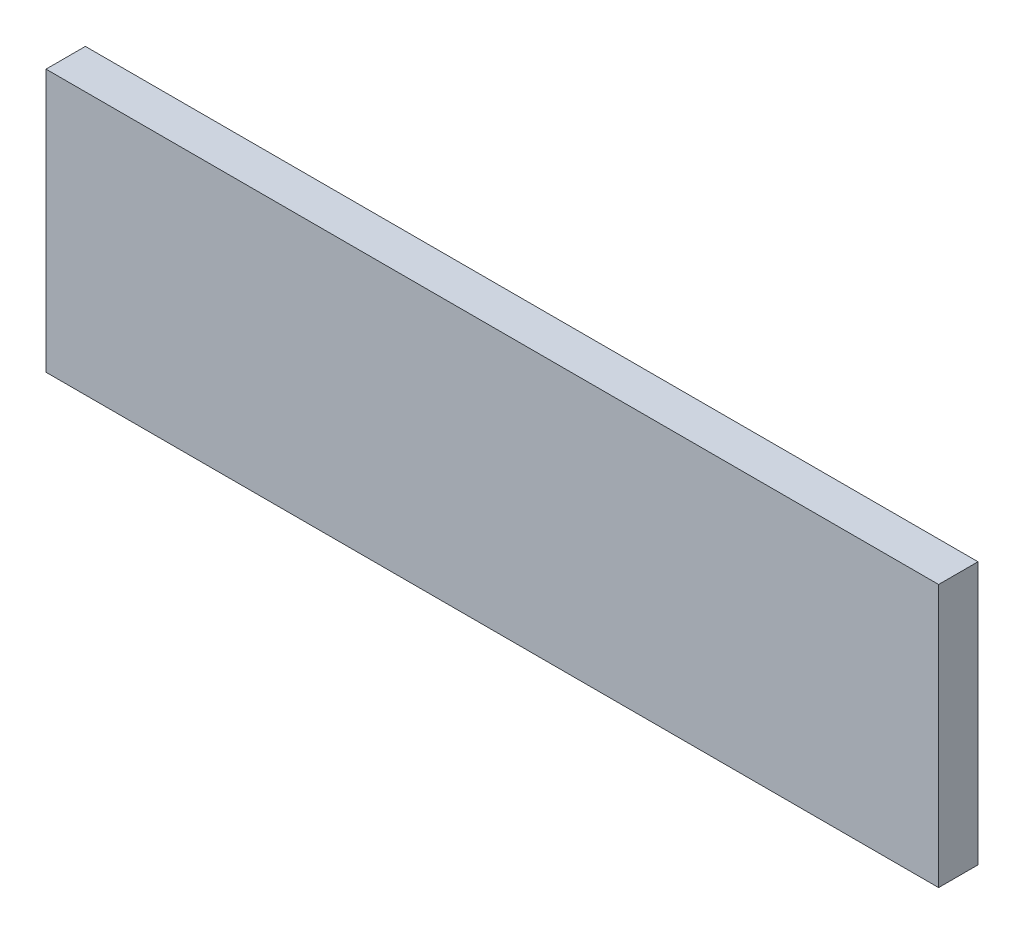
from build123d import *

# Parameters (mm, degrees)
SKETCH1_W           = 431.8
SKETCH1_H           = 127
BOSS_EXTRUDE1_DEPTH = 19.05


with BuildPart() as part:
    # Sketch1 → Boss-Extrude1 (new body)
    with BuildSketch(Plane.XY):
        with Locations((215.9, 63.5)):
            Rectangle(SKETCH1_W, SKETCH1_H)
    extrude(amount=BOSS_EXTRUDE1_DEPTH)


solid = part.part
